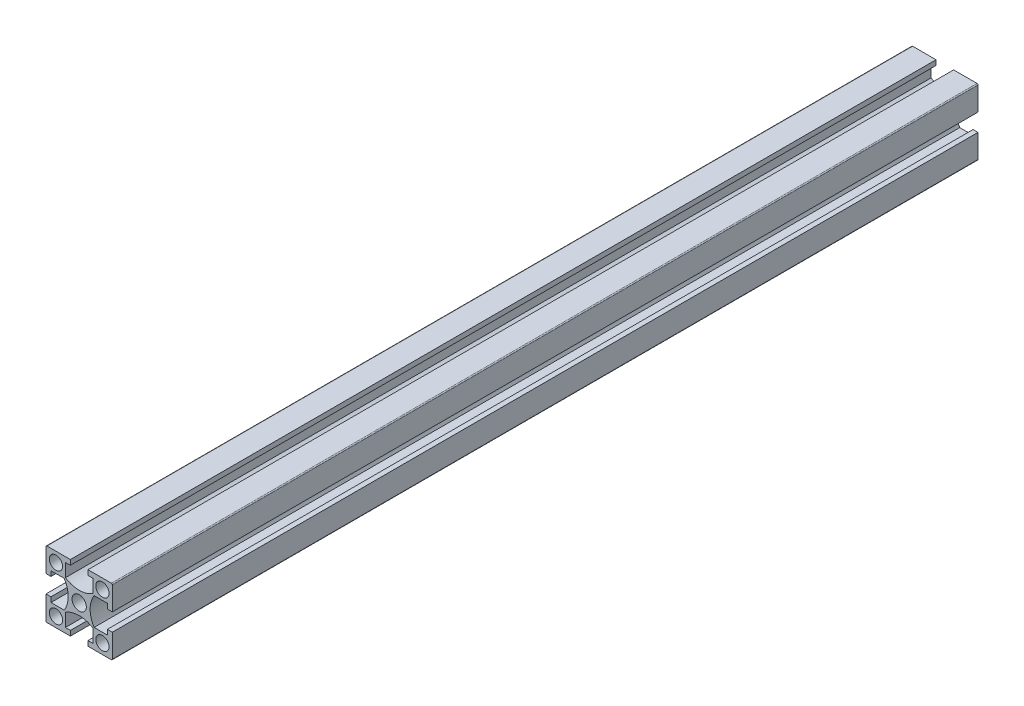
from build123d import *

# Parameters (mm, degrees)
SKETCH_1_W               = 20
SKETCH_1_H               = 20
SKETCH_1_R               = 2
SKETCH_1_R_2             = 2.15
EXTRUDE_1_DEPTH          = 261
CUT_EXTRUDE_1_REACH      = 263.383
PATTERN_CIRCULAR_1_COUNT = 4
FILLET_1_R               = 0.3


with BuildPart() as part:
    # 스케치1 → 보스-돌출1 (new body)
    with BuildSketch(Plane.XY):
        Rectangle(SKETCH_1_W, SKETCH_1_H)
        with Locations((-7, -7)):
            Circle(SKETCH_1_R, mode=Mode.SUBTRACT)
        with Locations((7, -7)):
            Circle(SKETCH_1_R, mode=Mode.SUBTRACT)
        with Locations((-7, 7)):
            Circle(SKETCH_1_R, mode=Mode.SUBTRACT)
        Circle(SKETCH_1_R_2, mode=Mode.SUBTRACT)
        with Locations((7, 7)):
            Circle(SKETCH_1_R, mode=Mode.SUBTRACT)
    extrude(amount=EXTRUDE_1_DEPTH)

    # 스케치1<3> → 컷-돌출1 (cut, up to next)
    with BuildSketch(Plane.XY, mode=Mode.PRIVATE) as cut_extrude_1_sk1:
        with BuildLine():
            Line((-8.5, 2.65), (-10, 2.65))
            Line((-10, 2.65), (-10, -2.65))
            Line((-10, -2.65), (-8.5, -2.65))
            Line((-8.5, -2.65), (-8.5, -4.15))
            Line((-8.5, -4.15), (-4.503166667, -4.15))
            ThreePointArc((-4.503166667, -4.15), (-3.3, 0), (-4.503166667, 4.15))
            Line((-4.503166667, 4.15), (-8.5, 4.15))
            Line((-8.5, 4.15), (-8.5, 2.65))
        make_face()
    cut_extrude_1_tool1 = extrude(cut_extrude_1_sk1.sketch, amount=CUT_EXTRUDE_1_REACH, mode=Mode.PRIVATE) & part.part
    cut_extrude_1 = cut_extrude_1_tool1.solids().sort_by_distance((-6.606913, 0, 0))[0]
    add(cut_extrude_1, mode=Mode.SUBTRACT)

    # 원형 패턴1: 컷-돌출1 ×4 about axis
    pattern_circular_1_axis = Axis((0, 0, 261), (0, 0, -1))
    for i in range(1, PATTERN_CIRCULAR_1_COUNT):
        add(cut_extrude_1.rotate(pattern_circular_1_axis, i * 360 / PATTERN_CIRCULAR_1_COUNT), mode=Mode.SUBTRACT)

    # 필렛1
    fillet_1_edges = [part.edges().sort_by_distance(p)[0] for p in [
        (10, -10, 130.5),
        (-10, -10, 130.5),
        (-10, 10, 130.5),
        (10, 10, 130.5),
    ]]
    fillet(fillet_1_edges, radius=FILLET_1_R)


solid = part.part
